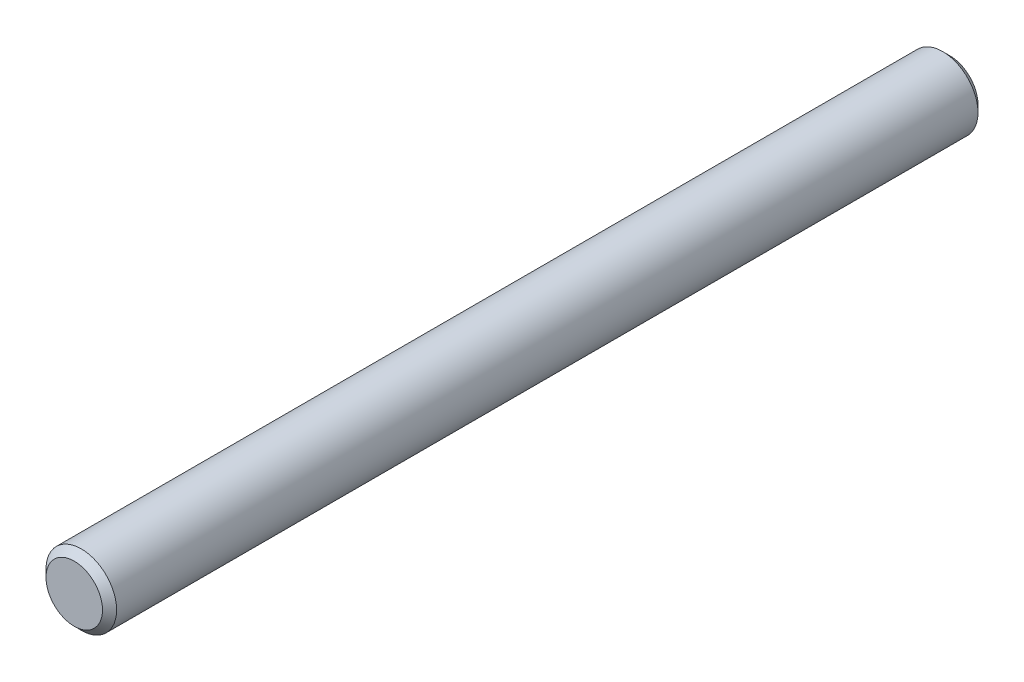
from build123d import *

# Parameters (mm, degrees)
SZKIC1_R                    = 2.5
DODANIE_WYCI_GNI_CIE1_DEPTH = 62
SFAZOWANIE1_SIZE            = 0.5


with BuildPart() as part:
    # Szkic1 → Dodanie-wyciągnięcie1 (new body)
    with BuildSketch(Plane.XY):
        Circle(SZKIC1_R)
    extrude(amount=DODANIE_WYCI_GNI_CIE1_DEPTH)

    # Sfazowanie1
    sfazowanie1_edges = [part.edges().sort_by_distance(p)[0] for p in [
        (-2.5, 0, 0),
        (-2.5, 0, 62),
    ]]
    chamfer(sfazowanie1_edges, length=SFAZOWANIE1_SIZE)


solid = part.part
